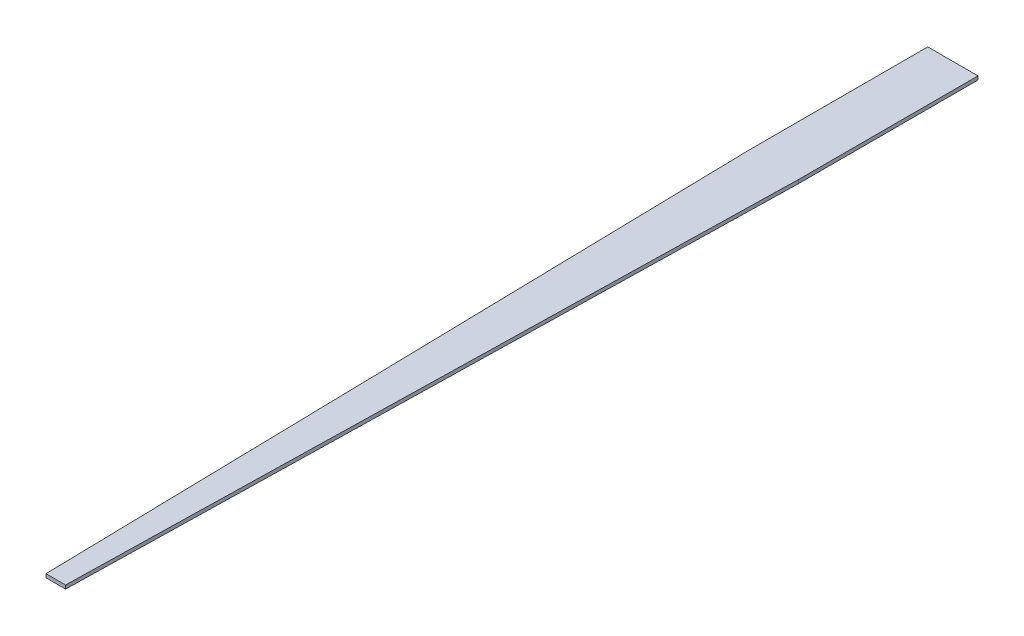
from build123d import *

# Parameters (mm, degrees)
BOSS_EXTRUDE1_DEPTH = 1
SKETCH2_W           = 14
SKETCH2_H           = 50
BOSS_EXTRUDE2_DEPTH = 1


with BuildPart() as part:
    # Sketch1 → Boss-Extrude1 (new body)
    with BuildSketch(Plane(origin=(0, 0, 0), x_dir=(1, 0, 0), z_dir=(0, 1, 0))):
        Polygon((9.725, 200), (4.275, 200), (0, 200), (4.275, 0), (9.725, 0), (14, 200), align=None)
    extrude(amount=BOSS_EXTRUDE1_DEPTH)

    # Sketch2 → Boss-Extrude2 (add)
    with BuildSketch(Plane.XZ):
        with Locations((7, -225)):
            Rectangle(SKETCH2_W, SKETCH2_H)
    extrude(amount=-BOSS_EXTRUDE2_DEPTH)


solid = part.part
